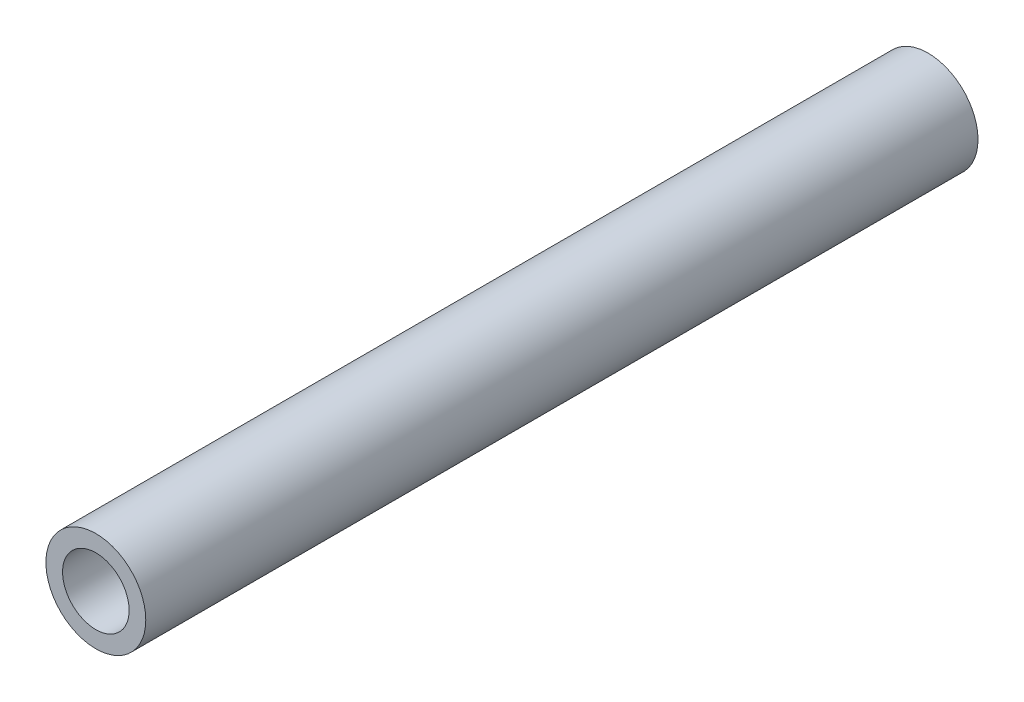
from build123d import *

# Parameters (mm, degrees)
SKETCH_1_R      = 3
SKETCH_1_R_2    = 2
EXTRUDE_1_DEPTH = 25


with BuildPart() as part:
    # 草图1 → 凸台-拉伸1 (new, symmetric)
    with BuildSketch(Plane.XY):
        Circle(SKETCH_1_R)
        Circle(SKETCH_1_R_2, mode=Mode.SUBTRACT)
    extrude(amount=EXTRUDE_1_DEPTH, both=True)


solid = part.part
